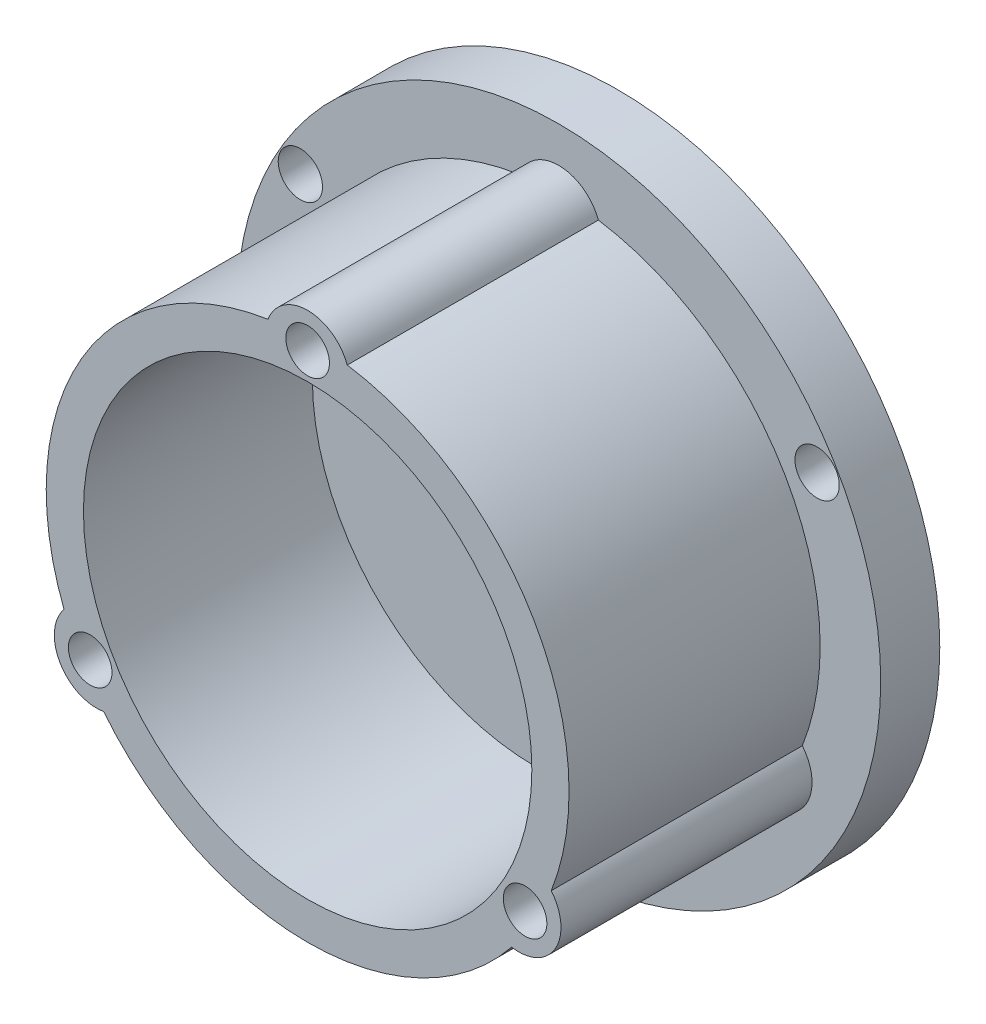
from build123d import *

# Parameters (mm, degrees)
SKETCH_1_R           = 20
SKETCH_1_R_2         = 15.75
EXTRUDE_1_DEPTH      = 5
EXTRUDE_2_DEPTH      = 8
SKETCH_3_R           = 18
EXTRUDE_3_DEPTH      = 13
EXTRUDE_6_DEPTH      = 8
SKETCH_4_R           = 15
CUT_EXTRUDE_1_DEPTH  = 15.5
SKETCH_7_R           = 3
CUT_EXTRUDE_2_DEPTH  = 10
EXTRUDE_7_REACH      = 92.44
SKETCH_9_R           = 1.475
CUT_EXTRUDE_3_DEPTH  = 5
SKETCH_10_W          = 1.475
SKETCH_10_H          = 47.880376143
SKETCH_11_W          = 47.783072431
SKETCH_11_H          = 1.475
CUT_EXTRUDE_START    = -2
SKETCH_12_R          = 3
CUT_EXTRUDE_4_DEPTH  = 2
SKETCH_13_R          = 15.15
SKETCH_13_R_2        = 15.25
SKETCH_13_R_3        = 15.18
CUT_EXTRUDE_5_DEPTH  = 15.5
SKETCH_14_R          = 15.75
CUT_EXTRUDE_6_DEPTH  = 8
CUT_EXTRUDE_START_2  = -17
SKETCH_15_R          = 110.73530619
CUT_EXTRUDE_8_DEPTH  = 17
SKETCH_16_R          = 128.173460151
SKETCH_16_R_2        = 21.8
CUT_EXTRUDE_10_DEPTH = 9
SKETCH_18_R          = 4.1
CUT_EXTRUDE_12_DEPTH = 10
SKETCH_19_R          = 1.5
CUT_EXTRUDE_14_DEPTH = 10


with BuildPart() as part:
    # 草图1 → 凸台-拉伸1 (new body)
    with BuildSketch(Plane.XY):
        Circle(SKETCH_1_R)
        Circle(SKETCH_1_R_2, mode=Mode.SUBTRACT)
    extrude(amount=EXTRUDE_1_DEPTH)

    # 草图2 → 凸台-拉伸2 (add)
    with BuildSketch(Plane.XY.offset(5)):
        with BuildLine():
            ThreePointArc((0, -25.892443989), (42.435244785, -24.5), (22.423514261, 12.946221995))
            ThreePointArc((22.423514261, 12.946221995), (0, 49), (-22.423514261, 12.946221995))
            ThreePointArc((-22.423514261, 12.946221995), (-42.435244785, -24.5), (0, -25.892443989))
        make_face()
    extrude(amount=EXTRUDE_2_DEPTH)

    # 草图3 → 凸台-拉伸3 (add)
    with BuildSketch(Plane.XY.offset(13)):
        with Locations(Location((0, 42, 0), (0, 0, 182.034073739))):
            Circle(SKETCH_3_R)
        with Locations(Location((36.373066959, -21, 0), (0, 0, 237.965926261))):
            Circle(SKETCH_3_R)
        with Locations(Location((-36.373066959, -21, 0), (0, 0, 117.965926261))):
            Circle(SKETCH_3_R)
    extrude(amount=EXTRUDE_3_DEPTH)

    # 草图8 → 凸台-拉伸6 (add)
    with BuildSketch(Plane(origin=(0, 0, 5), x_dir=(-1, 0, 0), z_dir=(0, 0, -1))):
        with BuildLine():
            ThreePointArc((28.527895654, -41.553668461), (55.425625842, -32), (50.250480335, -3.929048123))
            ThreePointArc((50.250480335, -3.929048123), (31.431769398, 18.147140523), (21.72258468, 45.482716583))
            ThreePointArc((21.72258468, 45.482716583), (0, 64), (-21.72258468, 45.482716583))
            ThreePointArc((-21.72258468, 45.482716583), (-31.431769398, 18.147140523), (-50.250480335, -3.929048123))
            ThreePointArc((-50.250480335, -3.929048123), (-55.425625842, -32), (-28.527895654, -41.553668461))
            ThreePointArc((-28.527895654, -41.553668461), (0, -36.294281046), (28.527895654, -41.553668461))
        make_face()
        with BuildLine():
            ThreePointArc((22.423514261, 12.946221995), (42.435244785, -24.5), (0, -25.892443989))
            ThreePointArc((0, -25.892443989), (-42.435244785, -24.5), (-22.423514261, 12.946221995))
            ThreePointArc((-22.423514261, 12.946221995), (0, 49), (22.423514261, 12.946221995))
        make_face(mode=Mode.SUBTRACT)
    extrude(amount=-EXTRUDE_6_DEPTH)

    # 草图4 → 切除-拉伸1 (cut)
    with BuildSketch(Plane.XY.offset(26)):
        with Locations((0, 42)):
            Circle(SKETCH_4_R)
        with Locations((36.373066959, -21)):
            Circle(SKETCH_4_R)
        with Locations((-36.373066959, -21)):
            Circle(SKETCH_4_R)
    extrude(amount=-CUT_EXTRUDE_1_DEPTH, mode=Mode.SUBTRACT)

    # 草图7 → 切除-拉伸2 (cut)
    with BuildSketch(Plane.XY.offset(10.5)):
        with Locations((0, 42)):
            Circle(SKETCH_7_R)
        with Locations((36.373066959, -21)):
            Circle(SKETCH_7_R)
        with Locations((-36.373066959, -21)):
            Circle(SKETCH_7_R)
    extrude(amount=-CUT_EXTRUDE_2_DEPTH, mode=Mode.SUBTRACT)

    # 草图6 → 凸台-拉伸7 (add, up to next)
    with BuildSketch(Plane.XY.offset(26), mode=Mode.PRIVATE) as extrude_7_sk1:
        with BuildLine():
            ThreePointArc((2.644358031, 56.765072658), (0, 61.66268909), (-2.644358031, 56.765072658))
            ThreePointArc((-2.644358031, 56.765072658), (0, 57), (2.644358031, 56.765072658))
        make_face()
    extrude_7_tool1 = extrude(extrude_7_sk1.sketch, amount=-EXTRUDE_7_REACH, mode=Mode.PRIVATE) - part.part
    # 草图6 → 凸台-拉伸7 (add, up to next)
    with BuildSketch(Plane.XY.offset(26), mode=Mode.PRIVATE) as extrude_7_sk2:
        with BuildLine():
            ThreePointArc((11.464748995, 32.327382439), (17.028388258, 32.168655455), (14.109107026, 36.907544902))
            ThreePointArc((14.109107026, 36.907544902), (12.990381057, 34.5), (11.464748995, 32.327382439))
        make_face()
    extrude_7_tool2 = extrude(extrude_7_sk2.sketch, amount=-EXTRUDE_7_REACH, mode=Mode.PRIVATE) - part.part
    # 草图6 → 凸台-拉伸7 (add, up to next)
    with BuildSketch(Plane.XY.offset(26), mode=Mode.PRIVATE) as extrude_7_sk3:
        with BuildLine():
            ThreePointArc((-14.109107026, 36.907544902), (-17.028388258, 32.168655455), (-11.464748995, 32.327382439))
            ThreePointArc((-11.464748995, 32.327382439), (-12.990381057, 34.5), (-14.109107026, 36.907544902))
        make_face()
    extrude_7_tool3 = extrude(extrude_7_sk3.sketch, amount=-EXTRUDE_7_REACH, mode=Mode.PRIVATE) - part.part
    # 草图6 → 凸台-拉伸7 (add, up to next)
    with BuildSketch(Plane.XY.offset(26), mode=Mode.PRIVATE) as extrude_7_sk4:
        with BuildLine():
            ThreePointArc((47.837815954, -30.672617561), (53.401455217, -30.831344545), (50.482173985, -26.092455098))
            ThreePointArc((50.482173985, -26.092455098), (49.363448016, -28.5), (47.837815954, -30.672617561))
        make_face()
    extrude_7_tool4 = extrude(extrude_7_sk4.sketch, amount=-EXTRUDE_7_REACH, mode=Mode.PRIVATE) - part.part
    # 草图6 → 凸台-拉伸7 (add, up to next)
    with BuildSketch(Plane.XY.offset(26), mode=Mode.PRIVATE) as extrude_7_sk5:
        with BuildLine():
            ThreePointArc((22.263959933, -26.092455098), (19.344678701, -30.831344545), (24.908317964, -30.672617561))
            ThreePointArc((24.908317964, -30.672617561), (23.382685902, -28.5), (22.263959933, -26.092455098))
        make_face()
    extrude_7_tool5 = extrude(extrude_7_sk5.sketch, amount=-EXTRUDE_7_REACH, mode=Mode.PRIVATE) - part.part
    # 草图6 → 凸台-拉伸7 (add, up to next)
    with BuildSketch(Plane.XY.offset(26), mode=Mode.PRIVATE) as extrude_7_sk6:
        with BuildLine():
            ThreePointArc((39.01742499, -6.234927342), (36.373066959, -1.33731091), (33.728708928, -6.234927342))
            ThreePointArc((33.728708928, -6.234927342), (36.373066959, -6), (39.01742499, -6.234927342))
        make_face()
    extrude_7_tool6 = extrude(extrude_7_sk6.sketch, amount=-EXTRUDE_7_REACH, mode=Mode.PRIVATE) - part.part
    # 草图6 → 凸台-拉伸7 (add, up to next)
    with BuildSketch(Plane.XY.offset(26), mode=Mode.PRIVATE) as extrude_7_sk7:
        with BuildLine():
            ThreePointArc((-50.482173985, -26.092455098), (-53.401455217, -30.831344545), (-47.837815954, -30.672617561))
            ThreePointArc((-47.837815954, -30.672617561), (-49.363448016, -28.5), (-50.482173985, -26.092455098))
        make_face()
    extrude_7_tool7 = extrude(extrude_7_sk7.sketch, amount=-EXTRUDE_7_REACH, mode=Mode.PRIVATE) - part.part
    # 草图6 → 凸台-拉伸7 (add, up to next)
    with BuildSketch(Plane.XY.offset(26), mode=Mode.PRIVATE) as extrude_7_sk8:
        with BuildLine():
            ThreePointArc((-33.728708928, -6.234927342), (-36.373066959, -1.33731091), (-39.01742499, -6.234927342))
            ThreePointArc((-39.01742499, -6.234927342), (-36.373066959, -6), (-33.728708928, -6.234927342))
        make_face()
    extrude_7_tool8 = extrude(extrude_7_sk8.sketch, amount=-EXTRUDE_7_REACH, mode=Mode.PRIVATE) - part.part
    # 草图6 → 凸台-拉伸7 (add, up to next)
    with BuildSketch(Plane.XY.offset(26), mode=Mode.PRIVATE) as extrude_7_sk9:
        with BuildLine():
            ThreePointArc((-24.908317964, -30.672617561), (-19.344678701, -30.831344545), (-22.263959933, -26.092455098))
            ThreePointArc((-22.263959933, -26.092455098), (-23.382685902, -28.5), (-24.908317964, -30.672617561))
        make_face()
    extrude_7_tool9 = extrude(extrude_7_sk9.sketch, amount=-EXTRUDE_7_REACH, mode=Mode.PRIVATE) - part.part
    add(extrude_7_tool1.solids().sort_by_distance((0, 59.041522, 26))[0])
    add(extrude_7_tool2.solids().sort_by_distance((14.758391, 33.479239, 26))[0])
    add(extrude_7_tool3.solids().sort_by_distance((-14.758391, 33.479239, 26))[0])
    add(extrude_7_tool4.solids().sort_by_distance((51.131457, -29.520761, 26))[0])
    add(extrude_7_tool5.solids().sort_by_distance((21.614676, -29.520761, 26))[0])
    add(extrude_7_tool6.solids().sort_by_distance((36.373067, -3.958478, 26))[0])
    add(extrude_7_tool7.solids().sort_by_distance((-51.131457, -29.520761, 26))[0])
    add(extrude_7_tool8.solids().sort_by_distance((-36.373067, -3.958478, 26))[0])
    add(extrude_7_tool9.solids().sort_by_distance((-21.614676, -29.520761, 26))[0])

    # 草图9 → 切除-拉伸3 (cut)
    with BuildSketch(Plane.XY.offset(26)):
        with Locations((0, 59)):
            Circle(SKETCH_9_R)
        with Locations((14.722431864, 33.5)):
            Circle(SKETCH_9_R)
        with Locations((-14.722431864, 33.5)):
            Circle(SKETCH_9_R)
        with Locations((51.095498823, -29.5)):
            Circle(SKETCH_9_R)
        with Locations((21.650635095, -29.5)):
            Circle(SKETCH_9_R)
        with Locations((36.373066959, -4)):
            Circle(SKETCH_9_R)
        with Locations((-51.095498823, -29.5)):
            Circle(SKETCH_9_R)
        with Locations((-36.373066959, -4)):
            Circle(SKETCH_9_R)
        with Locations((-21.650635095, -29.5)):
            Circle(SKETCH_9_R)
    extrude(amount=-CUT_EXTRUDE_3_DEPTH, mode=Mode.SUBTRACT)

    # 草图10 → 切除-旋转1 (revolve, cut)
    with BuildSketch(Plane(origin=(0, 0, 2.5), x_dir=(-1, 0, 0), z_dir=(0, 0, -1)), mode=Mode.PRIVATE) as cut_revolve_1_sk:
        with Locations((0.7375, -0.269128361)):
            Rectangle(SKETCH_10_W, SKETCH_10_H)
    revolve(cut_revolve_1_sk.sketch.rotate(Axis((0, 26.597082696, 2.5), (0, -1, 0)), 270), axis=Axis((0, 26.597082696, 2.5), (0, -1, 0)), mode=Mode.SUBTRACT)

    # 草图11 → 切除-旋转2 (revolve, cut)
    with BuildSketch(Plane(origin=(0, 0, 2.5), x_dir=(-1, 0, 0), z_dir=(0, 0, -1)), mode=Mode.PRIVATE) as cut_revolve_2_sk:
        with Locations((0.227220258, 0.7375)):
            Rectangle(SKETCH_11_W, SKETCH_11_H)
    revolve(cut_revolve_2_sk.sketch.rotate(Axis((35.344622551, 0, 2.5), (-1, 0, 0)), 90), axis=Axis((35.344622551, 0, 2.5), (-1, 0, 0)), mode=Mode.SUBTRACT)

    # 草图12 → 切除-拉伸4 (cut)
    # profile 1 of 3: a face of its own
    with BuildSketch(Plane(origin=(0, 0, 5), x_dir=(-1, 0, 0), z_dir=(0, 0, -1)).offset(CUT_EXTRUDE_START)):
        Polygon((-6.75, 32), (0, 32), (6.75, 32), (6.75, 60), (-6.75, 60), align=None)
        with Locations(Location((0, 42, 0), (0, 0, 180))):
            Circle(SKETCH_12_R, mode=Mode.SUBTRACT)
    # profile 2 of 3: a face of its own
    with BuildSketch(Plane(origin=(0, 0, 5), x_dir=(-1, 0, 0), z_dir=(0, 0, -1)).offset(CUT_EXTRUDE_START)):
        Polygon((-31.087812921, -10.154328524), (-55.336524227, -24.154328524), (-48.586524227, -35.845671476), (-24.337812921, -21.845671476), (-27.712812921, -16), align=None)
        with Locations(Location((-36.373066959, -21, 0), (0, 0, 180))):
            Circle(SKETCH_12_R, mode=Mode.SUBTRACT)
    # profile 3 of 3: a face of its own
    with BuildSketch(Plane(origin=(0, 0, 5), x_dir=(-1, 0, 0), z_dir=(0, 0, -1)).offset(CUT_EXTRUDE_START)):
        Polygon((24.337812921, -21.845671476), (48.586524227, -35.845671476), (55.336524227, -24.154328524), (31.087812921, -10.154328524), (27.712812921, -16), align=None)
        with Locations(Location((36.373066959, -21, 0), (0, 0, 180))):
            Circle(SKETCH_12_R, mode=Mode.SUBTRACT)
    extrude(amount=CUT_EXTRUDE_4_DEPTH, mode=Mode.SUBTRACT)

    # 草图13 → 切除-拉伸5 (cut)
    with BuildSketch(Plane.XY.offset(26)):
        with Locations((0, 42)):
            Circle(SKETCH_13_R)
        with Locations((36.373066959, -21)):
            Circle(SKETCH_13_R_2)
        with Locations((-36.373066959, -21)):
            Circle(SKETCH_13_R_3)
    extrude(amount=-CUT_EXTRUDE_5_DEPTH, mode=Mode.SUBTRACT)

    # 草图14 → 切除-拉伸6 (cut)
    with BuildSketch(Plane(origin=(0, 0, 5), x_dir=(-1, 0, 0), z_dir=(0, 0, -1))):
        with Locations(Location((0, 0, 0), (0, 0, 180))):
            Circle(SKETCH_14_R)
    extrude(amount=-CUT_EXTRUDE_6_DEPTH, mode=Mode.SUBTRACT)

    # 草图15 → 切除-拉伸8 (cut)
    with BuildSketch(Plane.XY.offset(26).offset(CUT_EXTRUDE_START_2)):
        with Locations((-36.373066959, -21)):
            Circle(SKETCH_15_R)
        with BuildLine():
            ThreePointArc((-39.057160852, -3.504696631), (-51.701716606, -12.15), (-52.86649107, -27.423158187))
            ThreePointArc((-52.86649107, -27.423158187), (-53.141647596, -30.681344545), (-50.182397177, -32.072145182))
            ThreePointArc((-50.182397177, -32.072145182), (-36.373066959, -38.7), (-22.563736741, -32.072145182))
            ThreePointArc((-22.563736741, -32.072145182), (-19.604486322, -30.681344545), (-19.879642848, -27.423158187))
            ThreePointArc((-19.879642848, -27.423158187), (-21.044417312, -12.15), (-33.688973066, -3.504696631))
            ThreePointArc((-33.688973066, -3.504696631), (-36.373066959, -1.63731091), (-39.057160852, -3.504696631))
        make_face(mode=Mode.SUBTRACT)
    extrude(amount=CUT_EXTRUDE_8_DEPTH, mode=Mode.SUBTRACT)

    # 草图16 → 切除-拉伸10 (cut)
    with BuildSketch(Plane(origin=(0, 0, 9), x_dir=(-1, 0, 0), z_dir=(0, 0, -1))):
        with Locations((36.373066959, -21)):
            Circle(SKETCH_16_R)
        with Locations(Location((36.373066959, -21, 0), (0, 0, 180))):
            Circle(SKETCH_16_R_2, mode=Mode.SUBTRACT)
    extrude(amount=CUT_EXTRUDE_10_DEPTH, mode=Mode.SUBTRACT)

    # 草图18 → 切除-拉伸12 (cut)
    with BuildSketch(Plane(origin=(0, 0, 7), x_dir=(-1, 0, 0), z_dir=(0, 0, -1))):
        with Locations((36.373066959, -21)):
            Circle(SKETCH_18_R)
    extrude(amount=-CUT_EXTRUDE_12_DEPTH, mode=Mode.SUBTRACT)

    # 草图19 → 切除-拉伸14 (cut)
    with BuildSketch(Plane(origin=(0, 0, 5), x_dir=(-1, 0, 0), z_dir=(0, 0, -1))):
        with Locations((36.373066959, -41.2)):
            Circle(SKETCH_19_R)
        with Locations((18.879353802, -10.9)):
            Circle(SKETCH_19_R)
        with Locations((53.866780115, -10.9)):
            Circle(SKETCH_19_R)
    extrude(amount=-CUT_EXTRUDE_14_DEPTH, mode=Mode.SUBTRACT)


solid = part.part
